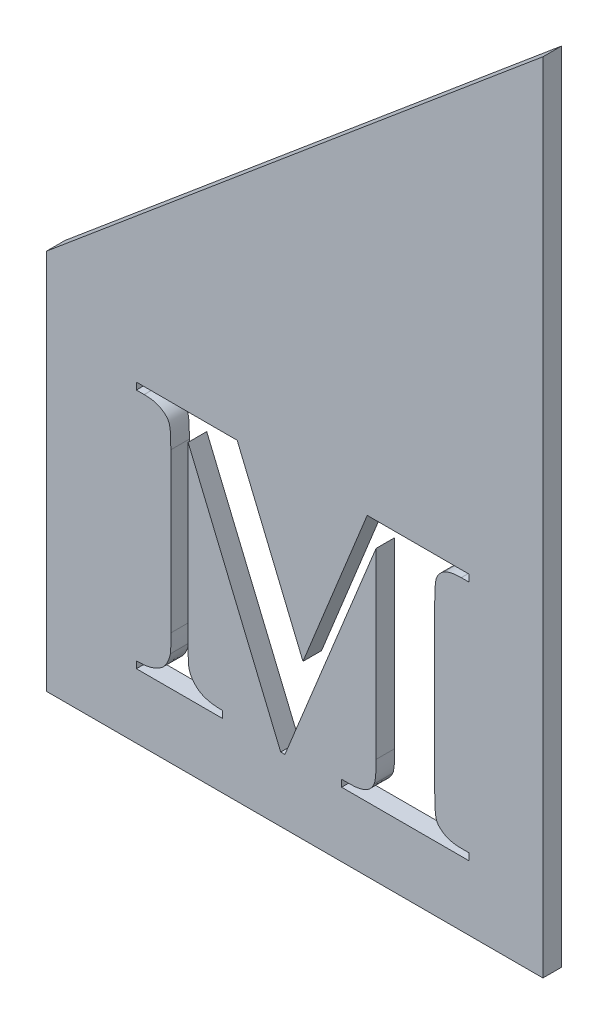
from build123d import *

# Parameters (mm, degrees)
BOSS_EXTRUDE1_DEPTH = 3
CUT_EXTRUDE1_DEPTH  = 3


with BuildPart() as part:
    # Sketch1 → Boss-Extrude1 (new body)
    with BuildSketch(Plane.XY):
        Polygon((73.208888624, 61.429551443), (153.208888624, 128.557521937), (153.208888624, 0), (73.208888624, 0), align=None)
    extrude(amount=BOSS_EXTRUDE1_DEPTH)

    # Sketch2 → Cut-Extrude1 (cut)
    with BuildSketch(Plane.XY.offset(3)):
        with BuildLine():
            Line((114.541115695, 24.848188193), (124.897018473, 50.403743749))
            Line((124.897018473, 50.403743749), (141.32931014, 50.403743749))
            Line((141.32931014, 50.403743749), (141.32931014, 49.292632638))
            Line((141.32931014, 49.292632638), (140.053268473, 49.292632638))
            add(Edge.make_bspline(
                [(140.053268473, 49.292632638), (139.777913916, 49.287279798), (139.250682366, 49.277030519), (138.50450005, 49.164580552), (137.836795314, 48.980086144), (137.446503851, 48.781055794), (137.258129584, 48.684993749)],
                knots=[0, 0, 0, 0, 1.141675553, 2.186008389, 3.124476521, 4, 4, 4, 4], degree=3))
            add(Edge.make_bspline(
                [(137.258129584, 48.684993749), (137.138546651, 48.611673708), (136.896313732, 48.463153122), (136.596086342, 48.143316904), (136.306505192, 47.77978632), (136.167514751, 47.49054629), (136.09493514, 47.339507638)],
                knots=[0, 0, 0, 0, 0.92689117, 1.877555159, 2.891677582, 4, 4, 4, 4], degree=3))
            add(Edge.make_bspline(
                [(136.09493514, 47.339507638), (136.066604666, 47.270746405), (136.002068988, 47.114111084), (135.953061058, 46.830507124), (135.885354455, 46.485384284), (135.848925671, 46.066688386), (135.81416284, 45.583570509), (135.785726516, 45.030780096), (135.783396388, 44.408347319), (135.777079325, 43.968548261), (135.773754584, 43.737077082)],
                knots=[0, 0, 0, 0, 0.489997979, 1.116195674, 1.892481991, 2.815045661, 3.888305079, 5.094018216, 6.470549178, 8, 8, 8, 8], degree=3))
            Line((135.773754584, 43.737077082), (135.773754584, 17.070410415))
            add(Edge.make_bspline(
                [(135.773754584, 17.070410415), (135.777068496, 16.836044569), (135.783409978, 16.387563484), (135.785856575, 15.750682405), (135.813746186, 15.183392289), (135.849629159, 14.68588278), (135.884629459, 14.25556917), (135.954037997, 13.89602331), (136.002450601, 13.601431222), (136.111395778, 13.306263295), (136.290115509, 12.990352676), (136.581751189, 12.649113903), (136.961506114, 12.339403102), (137.415488976, 12.049727482), (137.954119231, 11.806372313), (138.580490143, 11.635507838), (139.288825096, 11.531956263), (139.789572455, 11.520754017), (140.053268473, 11.51485486)],
                knots=[0, 0, 0, 0, 1.348866943, 2.581183741, 3.664677528, 4.616142033, 5.452864999, 6.145451543, 6.723473748, 7.165912693, 7.948706057, 8.799395909, 9.733211935, 10.758727886, 11.891513365, 13.119773514, 14.483258592, 16, 16, 16, 16], degree=3))
            Line((140.053268473, 11.51485486), (141.32931014, 11.51485486))
            Line((141.32931014, 11.51485486), (141.32931014, 10.403743749))
            Line((141.32931014, 10.403743749), (120.773754584, 10.403743749))
            Line((120.773754584, 10.403743749), (120.773754584, 11.51485486))
            Line((120.773754584, 11.51485486), (122.049796251, 11.51485486))
            add(Edge.make_bspline(
                [(122.049796251, 11.51485486), (122.328100051, 11.519788417), (122.855467853, 11.52913719), (123.603877097, 11.645167884), (124.268464025, 11.825399233), (124.659288026, 12.020932183), (124.84493514, 12.113813193)],
                knots=[0, 0, 0, 0, 1.154913481, 2.188486767, 3.139504729, 4, 4, 4, 4], degree=3))
            add(Edge.make_bspline(
                [(124.84493514, 12.113813193), (124.963688543, 12.187882908), (125.205993367, 12.339014992), (125.522548533, 12.651091277), (125.789467027, 13.038073651), (125.933569987, 13.327111023), (126.008129584, 13.476660415)],
                knots=[0, 0, 0, 0, 0.919236091, 1.875612259, 2.900831081, 4, 4, 4, 4], degree=3))
            add(Edge.make_bspline(
                [(126.008129584, 13.476660415), (126.036482482, 13.545417481), (126.101069242, 13.70204331), (126.149089491, 13.982919397), (126.218719843, 14.324814277), (126.253857147, 14.740845033), (126.289303378, 15.226779271), (126.316933013, 15.779620532), (126.319830601, 16.402028189), (126.326027204, 16.838937549), (126.32931014, 17.070410415)],
                knots=[0, 0, 0, 0, 0.491154816, 1.118830903, 1.878082211, 2.802823963, 3.878617243, 5.106317376, 6.466938293, 8, 8, 8, 8], degree=3))
            Line((126.32931014, 17.070410415), (126.32931014, 46.51485486))
            Line((126.32931014, 46.51485486), (111.633129584, 10.403743749))
            Line((111.633129584, 10.403743749), (110.956046251, 10.403743749))
            Line((110.956046251, 10.403743749), (96.034171251, 46.167632638))
            Line((96.034171251, 46.167632638), (96.034171251, 18.181521526))
            add(Edge.make_bspline(
                [(96.034171251, 18.181521526), (96.033190657, 17.958710944), (96.031318524, 17.533324619), (96.043902342, 16.928659169), (96.047406401, 16.39312255), (96.069662028, 15.924639846), (96.080811254, 15.524733601), (96.111073311, 15.192481376), (96.131378595, 14.927855243), (96.160396628, 14.77570005), (96.17306014, 14.709299304)],
                knots=[0, 0, 0, 0, 1.537276861, 2.934943876, 4.172912213, 5.231790959, 6.170977958, 6.931994631, 7.533920913, 8, 8, 8, 8], degree=3))
            add(Edge.make_bspline(
                [(96.17306014, 14.709299304), (96.24207751, 14.479788853), (96.378508228, 14.02610197), (96.742519421, 13.413991548), (97.187520669, 12.855403415), (97.757425274, 12.365276459), (98.475961448, 11.965325093), (99.371323366, 11.71141388), (100.422324645, 11.533357851), (101.183703417, 11.521290215), (101.589726807, 11.51485486)],
                knots=[0, 0, 0, 0, 0.837202277, 1.654947254, 2.477083681, 3.333000774, 4.272846669, 5.334753209, 6.578693578, 8, 8, 8, 8], degree=3))
            Line((101.589726807, 11.51485486), (101.589726807, 10.403743749))
            Line((101.589726807, 10.403743749), (87.700837918, 10.403743749))
            Line((87.700837918, 10.403743749), (87.700837918, 11.51485486))
            Line((87.700837918, 11.51485486), (88.108824029, 11.51485486))
            add(Edge.make_bspline(
                [(88.108824029, 11.51485486), (88.326119555, 11.515958146), (88.753567478, 11.518128449), (89.380690167, 11.601723744), (89.986576932, 11.729328159), (90.561772547, 11.920334861), (91.096566285, 12.153779677), (91.557403695, 12.449291329), (91.967729934, 12.754532224), (92.297594099, 13.128470853), (92.579118316, 13.5527757), (92.820072335, 14.047801623), (93.041761578, 14.61157873), (93.142726903, 15.023158324), (93.195629584, 15.238813193)],
                knots=[0, 0, 0, 0, 1.126221598, 2.215421052, 3.275368575, 4.333933395, 5.355119513, 6.292312747, 7.169137372, 7.998144275, 8.864108371, 9.803942606, 10.849334424, 12, 12, 12, 12], degree=3))
            add(Edge.make_bspline(
                [(93.195629584, 15.238813193), (93.202214921, 15.276348515), (93.219826457, 15.376731332), (93.220721213, 15.565972366), (93.23219697, 15.826075335), (93.239616075, 16.156072479), (93.248148475, 16.55823406), (93.259127372, 17.03274832), (93.255551074, 17.582569372), (93.256100465, 17.973190342), (93.256393473, 18.181521526)],
                knots=[0, 0, 0, 0, 0.310187739, 0.829552458, 1.537439513, 2.433908972, 3.518989584, 4.816276497, 6.302014132, 8, 8, 8, 8], degree=3))
            Line((93.256393473, 18.181521526), (93.256393473, 43.737077082))
            add(Edge.make_bspline(
                [(93.256393473, 43.737077082), (93.253065361, 43.971441664), (93.246696704, 44.419920331), (93.244433013, 45.05681769), (93.215819555, 45.626940178), (93.181647654, 46.124609011), (93.144463395, 46.554666597), (93.077514309, 46.908858762), (93.026352876, 47.199976304), (92.918911223, 47.492567379), (92.740012849, 47.808500991), (92.448251073, 48.149453568), (92.067439137, 48.462006467), (91.607344322, 48.747016559), (91.066151715, 48.990534713), (90.439896314, 49.17604788), (89.726495128, 49.273958557), (89.223100805, 49.286215027), (88.959518473, 49.292632638)],
                knots=[0, 0, 0, 0, 1.347272511, 2.578132646, 3.660345685, 4.627277135, 5.446463535, 6.138231406, 6.69929032, 7.141206279, 7.92307434, 8.772758631, 9.705470838, 10.743855472, 11.875301939, 13.106723778, 14.485051461, 16, 16, 16, 16], degree=3))
            Line((88.959518473, 49.292632638), (87.700837918, 49.292632638))
            Line((87.700837918, 49.292632638), (87.700837918, 50.403743749))
            Line((87.700837918, 50.403743749), (103.942157362, 50.403743749))
            Line((103.942157362, 50.403743749), (114.541115695, 24.848188193))
        make_face()
    extrude(amount=-CUT_EXTRUDE1_DEPTH, mode=Mode.SUBTRACT)


solid = part.part
